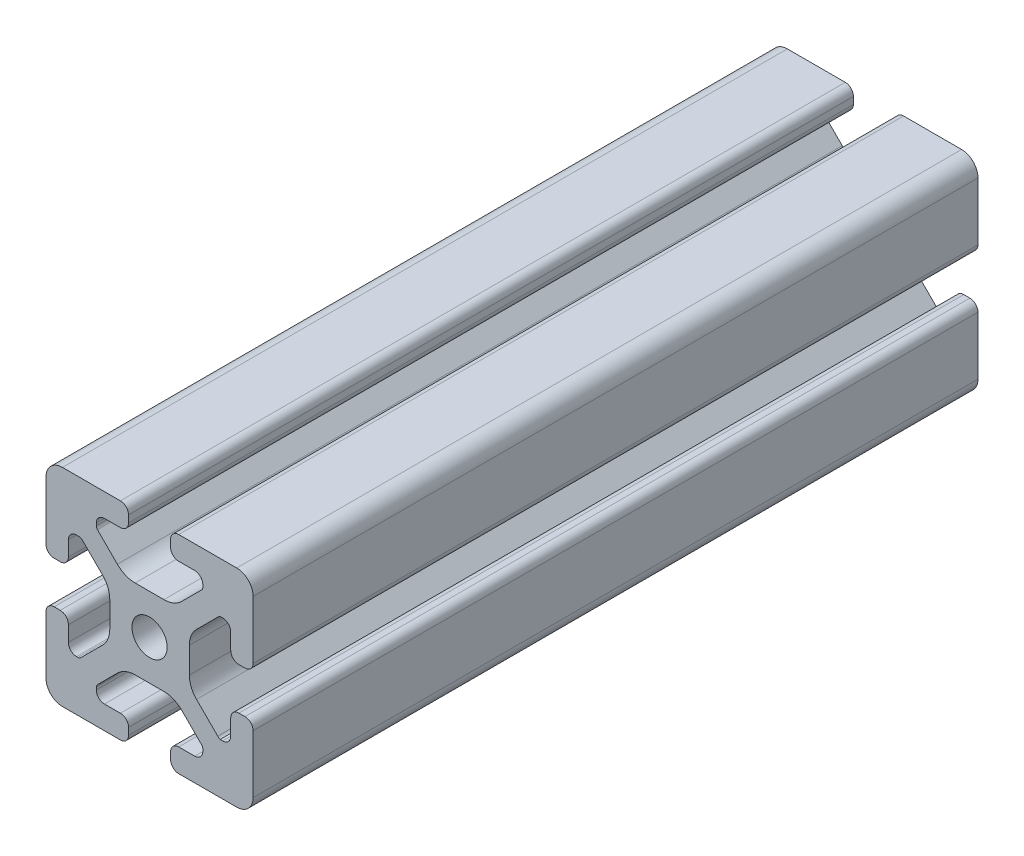
from build123d import *

# Parameters (mm, degrees)
SKETCH1_R      = 3.4
EXTRUDE1_DEPTH = 140


with BuildPart() as part:
    # Sketch1 → Extrude1 (new body)
    with BuildSketch(Plane.XY):
        with BuildLine():
            Line((-8.715, -15.524615034), (-5.63, -15.524615034))
            ThreePointArc((-5.63, -15.524615034), (-4.519842354, -15.984457388), (-4.06, -17.094615034))
            Line((-4.06, -17.094615034), (-4.06, -18.43))
            ThreePointArc((-4.06, -18.43), (-4.519842354, -19.540157646), (-5.63, -20))
            Line((-5.63, -20), (-16.674615034, -20))
            ThreePointArc((-16.674615034, -20), (-18.951578385, -19.194274381), (-20, -17.018368134))
            Line((-20, -17.018368134), (-20, -5.757918808))
            ThreePointArc((-20, -5.757918808), (-19.564709668, -4.603883664), (-18.43, -4.120449326))
            Line((-18.43, -4.120449326), (-17.25, -4.120449326))
            ThreePointArc((-17.25, -4.120449326), (-16.115287682, -4.60388249), (-15.67999625, -5.757919334))
            Line((-15.67999625, -5.757919334), (-15.67999625, -8.715399492))
            ThreePointArc((-15.67999625, -8.715399492), (-15.220153896, -9.825557139), (-14.10999625, -10.285399492))
            Line((-14.10999625, -10.285399492), (-13.816898819, -10.285399492))
            ThreePointArc((-13.816898819, -10.285399492), (-13.526061711, -10.227547119), (-13.279501941, -10.062800646))
            Line((-13.279501941, -10.062800646), (-9.076242789, -5.859541495))
            ThreePointArc((-9.076242789, -5.859541495), (-8.046572221, -4.318530588), (-7.685, -2.500784284))
            Line((-7.685, -2.500784284), (-7.685, 2.500784284))
            ThreePointArc((-7.685, 2.500784284), (-8.046572221, 4.318530588), (-9.076242789, 5.859541495))
            Line((-9.076242789, 5.859541495), (-13.040489136, 9.823787841))
            ThreePointArc((-13.040489136, 9.823787841), (-13.354224618, 10.012729352), (-13.71989919, 10.033001362))
            Line((-13.71989919, 10.033001362), (-14.05520779, 10.044710596))
            ThreePointArc((-14.05520779, 10.044710596), (-15.200613642, 9.605030484), (-15.68, 8.475666998))
            Line((-15.68, 8.475666998), (-15.68, 5.572979049))
            ThreePointArc((-15.68, 5.572979049), (-16.139842354, 4.462821403), (-17.25, 4.002979049))
            Line((-17.25, 4.002979049), (-18.43, 4.002979049))
            ThreePointArc((-18.43, 4.002979049), (-19.540157646, 4.462821403), (-20, 5.572979049))
            Line((-20, 5.572979049), (-20, 13.004526564))
            Line((-20, 13.004526564), (-20, 16.83))
            ThreePointArc((-20, 16.83), (-19.071528496, 19.071528496), (-16.83, 20))
            Line((-16.83, 20), (-5.63, 20))
            ThreePointArc((-5.63, 20), (-4.519842354, 19.540157646), (-4.06, 18.43))
            Line((-4.06, 18.43), (-4.06, 17.094615034))
            ThreePointArc((-4.06, 17.094615034), (-4.519842354, 15.984457388), (-5.63, 15.524615034))
            Line((-5.63, 15.524615034), (-8.715, 15.524615034))
            ThreePointArc((-8.715, 15.524615034), (-9.825157646, 15.06477268), (-10.285, 13.954615034))
            Line((-10.285, 13.954615034), (-10.285, 13.492503602))
            ThreePointArc((-10.285, 13.492503602), (-10.227148445, 13.201664194), (-10.062401154, 12.955102448))
            Line((-10.062401154, 12.955102448), (-6.217092793, 9.109794088))
            ThreePointArc((-6.217092793, 9.109794088), (-4.63891877, 8.055291919), (-2.777335583, 7.685))
            Line((-2.777335583, 7.685), (2.777335583, 7.685))
            ThreePointArc((2.777335583, 7.685), (4.63891877, 8.055291919), (6.217092793, 9.109794088))
            Line((6.217092793, 9.109794088), (10.062401154, 12.955102448))
            ThreePointArc((10.062401154, 12.955102448), (10.227148445, 13.201664194), (10.285, 13.492503602))
            Line((10.285, 13.492503602), (10.285, 13.954615034))
            ThreePointArc((10.285, 13.954615034), (9.825157646, 15.06477268), (8.715, 15.524615034))
            Line((8.715, 15.524615034), (5.63, 15.524615034))
            ThreePointArc((5.63, 15.524615034), (4.519842354, 15.984457388), (4.06, 17.094615034))
            Line((4.06, 17.094615034), (4.06, 18.43))
            ThreePointArc((4.06, 18.43), (4.519842354, 19.540157646), (5.63, 20))
            Line((5.63, 20), (12.979635074, 20))
            Line((12.979635074, 20), (16.83, 20))
            ThreePointArc((16.83, 20), (19.071528496, 19.071528496), (20, 16.83))
            Line((20, 16.83), (20, 13.001098436))
            Line((20, 13.001098436), (20, 5.63))
            ThreePointArc((20, 5.63), (19.540157461, 4.519842693), (18.43, 4.060000526))
            Line((18.43, 4.060000526), (17.24999625, 4.060000526))
            ThreePointArc((17.24999625, 4.060000526), (16.139838603, 4.519842879), (15.67999625, 5.630000526))
            Line((15.67999625, 5.630000526), (15.67999625, 8.715399492))
            ThreePointArc((15.67999625, 8.715399492), (15.220153896, 9.825557139), (14.10999625, 10.285399492))
            Line((14.10999625, 10.285399492), (13.816903094, 10.285399492))
            ThreePointArc((13.816903094, 10.285399492), (13.526063686, 10.227547937), (13.279501941, 10.062800646))
            Line((13.279501941, 10.062800646), (9.076242789, 5.859541495))
            ThreePointArc((9.076242789, 5.859541495), (8.046572221, 4.318530588), (7.685, 2.500784284))
            Line((7.685, 2.500784284), (7.685, -2.500784284))
            ThreePointArc((7.685, -2.500784284), (8.046572221, -4.318530588), (9.076242789, -5.859541495))
            Line((9.076242789, -5.859541495), (13.163657296, -9.946956002))
            ThreePointArc((13.163657296, -9.946956002), (13.35903797, -10.160433474), (13.6200547, -10.285399492))
            Line((13.6200547, -10.285399492), (14.10999625, -10.285399492))
            ThreePointArc((14.10999625, -10.285399492), (15.220153896, -9.825557139), (15.67999625, -8.715399492))
            Line((15.67999625, -8.715399492), (15.67999625, -5.630000526))
            ThreePointArc((15.67999625, -5.630000526), (16.139838603, -4.519842879), (17.24999625, -4.060000526))
            Line((17.24999625, -4.060000526), (18.43, -4.060000526))
            ThreePointArc((18.43, -4.060000526), (19.540157461, -4.519842693), (20, -5.63))
            Line((20, -5.63), (20, -16.83))
            ThreePointArc((20, -16.83), (19.071528496, -19.071528496), (16.83, -20))
            Line((16.83, -20), (13, -20))
            Line((13, -20), (5.63, -20))
            ThreePointArc((5.63, -20), (4.519842354, -19.540157646), (4.06, -18.43))
            Line((4.06, -18.43), (4.06, -17.094615034))
            ThreePointArc((4.06, -17.094615034), (4.519842354, -15.984457388), (5.63, -15.524615034))
            Line((5.63, -15.524615034), (8.715, -15.524615034))
            ThreePointArc((8.715, -15.524615034), (9.825157646, -15.06477268), (10.285, -13.954615034))
            Line((10.285, -13.954615034), (10.285, -13.492503602))
            ThreePointArc((10.285, -13.492503602), (10.227148445, -13.201664194), (10.062401154, -12.955102448))
            Line((10.062401154, -12.955102448), (6.217092793, -9.109794088))
            ThreePointArc((6.217092793, -9.109794088), (4.63891877, -8.055291919), (2.777335583, -7.685))
            Line((2.777335583, -7.685), (-2.777335583, -7.685))
            ThreePointArc((-2.777335583, -7.685), (-4.63891877, -8.055291919), (-6.217092793, -9.109794088))
            Line((-6.217092793, -9.109794088), (-10.062401154, -12.955102448))
            ThreePointArc((-10.062401154, -12.955102448), (-10.227148445, -13.201664194), (-10.285, -13.492503602))
            Line((-10.285, -13.492503602), (-10.285, -13.954615034))
            ThreePointArc((-10.285, -13.954615034), (-9.825157646, -15.06477268), (-8.715, -15.524615034))
        make_face()
        Circle(SKETCH1_R, mode=Mode.SUBTRACT)
    extrude(amount=-EXTRUDE1_DEPTH)


solid = part.part
